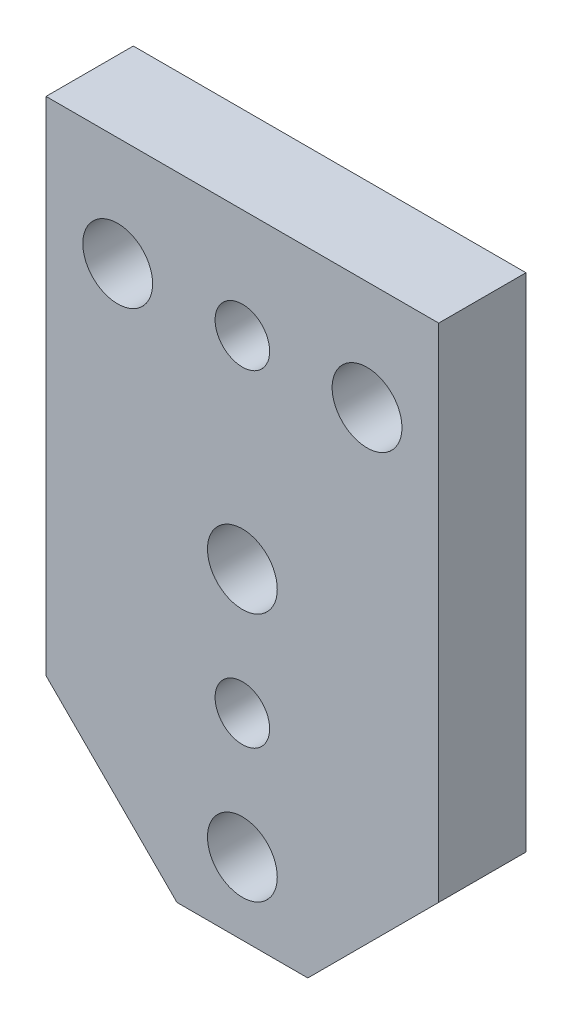
from build123d import *

# Parameters (mm, degrees)
SKETCH1_W            = 18
SKETCH1_H            = 10
BOSS_EXTRUDE1_DEPTH  = 2
SKETCH2_W            = 18
SKETCH2_H            = 19
BOSS_EXTRUDE2_DEPTH  = 2
M3_CLEARANCE_HOLE1_D = 3.2
CHAMFER1_SIZE        = 6
M3_TAPPED_HOLE1_D    = 2.5


with BuildPart() as part:
    # Sketch1 → Boss-Extrude1 (new, symmetric)
    with BuildSketch(Plane.XY):
        Rectangle(SKETCH1_W, SKETCH1_H)
    extrude(amount=BOSS_EXTRUDE1_DEPTH, both=True)

    # Sketch2 → Boss-Extrude2 (add, symmetric)
    with BuildSketch(Plane.XY):
        with Locations((0, -14.5)):
            Rectangle(SKETCH2_W, SKETCH2_H)
    extrude(amount=BOSS_EXTRUDE2_DEPTH, both=True)

    # M3 Clearance Hole1 (through all)
    with Locations(Plane(origin=(0, 0, 2), x_dir=(-1, 0, 0), z_dir=(0, 0, 1))):
        with Locations((0, 9.268), (0, 20.698), (-5.715, -0.0028), (5.715, -0.0028)):
            Hole(M3_CLEARANCE_HOLE1_D / 2)

    # Chamfer1
    chamfer1_edges = [part.edges().sort_by_distance(p)[0] for p in [
        (-9, -24, 0),
        (9, -24, 0),
    ]]
    chamfer(chamfer1_edges, length=CHAMFER1_SIZE)

    # M3 Tapped Hole1 (through all)
    with Locations(Plane.XY.offset(2)):
        with Locations((0, -14.983), (0, 0.0028)):
            Hole(M3_TAPPED_HOLE1_D / 2)


solid = part.part
